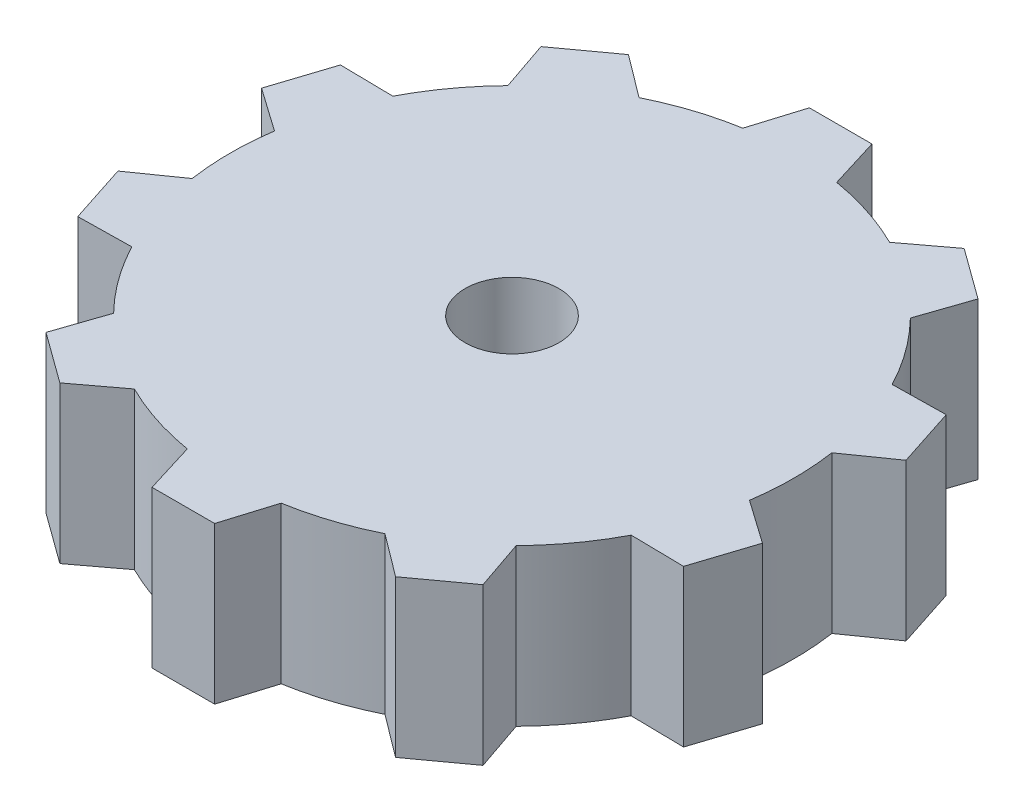
from build123d import *

# Parameters (mm, degrees)
SKETCH_1_R               = 9
SKETCH_1_R_2             = 1.5
EXTRUDE_1_DEPTH          = 5
EXTRUDE_START            = -5
EXTRUDE_2_DEPTH          = 5
PATTERN_CIRCULAR_1_COUNT = 10


with BuildPart() as part:
    # 草图1 → 凸台-拉伸1 (new body)
    with BuildSketch(Plane(origin=(0, 0, 0), x_dir=(1, 0, 0), z_dir=(0, 1, 0))):
        with Locations(Location((0, 0, 0), (0, 0, 270))):
            Circle(SKETCH_1_R)
        with Locations(Location((0, 0, 0), (0, 0, 270))):
            Circle(SKETCH_1_R_2, mode=Mode.SUBTRACT)
    extrude(amount=EXTRUDE_1_DEPTH)

    # 草图2 → 凸台-拉伸2 (add)
    with BuildSketch(Plane(origin=(0, 5, 0), x_dir=(1, 0, 0), z_dir=(0, 1, 0)).offset(EXTRUDE_START)):
        with BuildLine():
            Line((1.5, 8.874119675), (1, 10.5))
            Line((1, 10.5), (-1, 10.5))
            Line((-1, 10.5), (-1.5, 8.874119675))
            ThreePointArc((-1.5, 8.874119675), (0, 9), (1.5, 8.874119675))
        make_face()
    extrude_2 = extrude(amount=EXTRUDE_2_DEPTH)

    # 阵列(圆周)1: 凸台-拉伸2 ×10 about axis
    pattern_circular_1_axis = Axis((0, 0, 0), (0, 1, 0))
    for i in range(1, PATTERN_CIRCULAR_1_COUNT):
        add(extrude_2.rotate(pattern_circular_1_axis, i * 360 / PATTERN_CIRCULAR_1_COUNT))


solid = part.part
